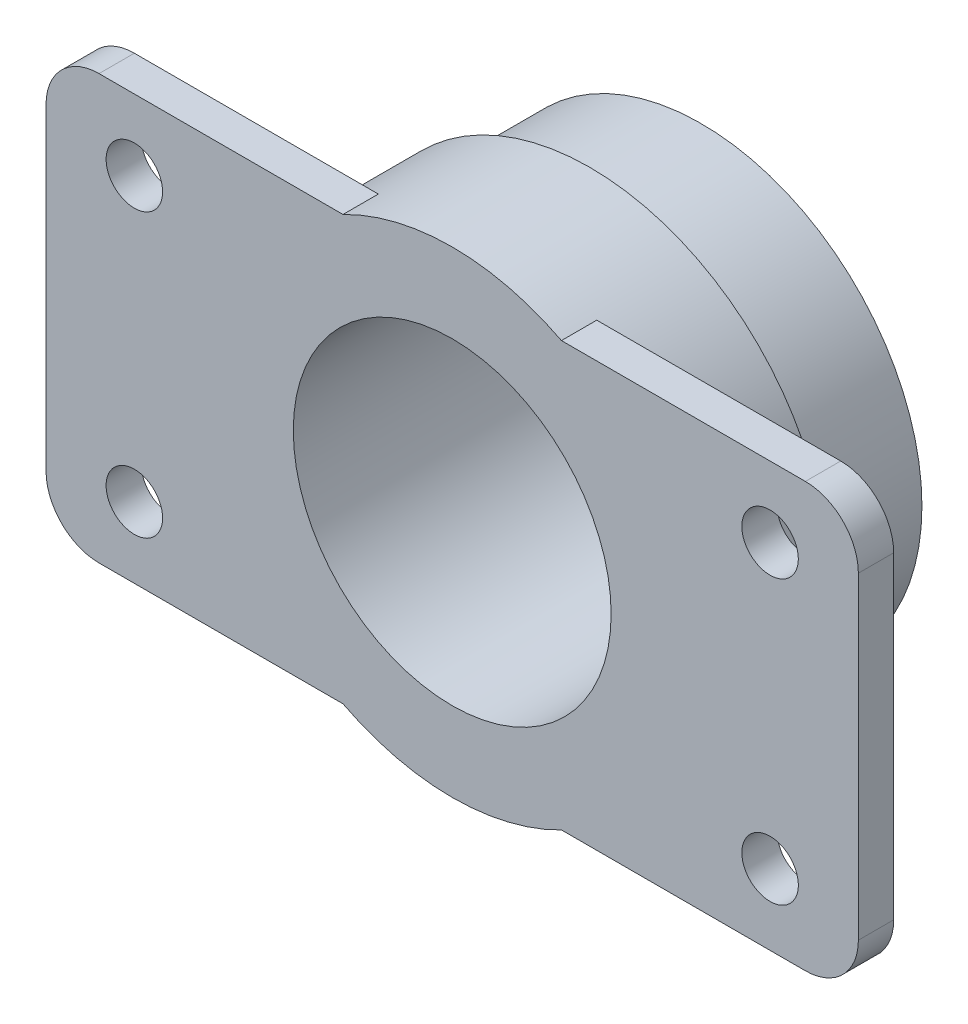
from build123d import *

# Parameters (mm, degrees)
SKETCH_1_R      = 12.5
SKETCH_1_R_2    = 9
EXTRUDE_1_DEPTH = 6.3
SKETCH_2_R      = 13.5
SKETCH_2_R_2    = 9
EXTRUDE_2_DEPTH = 5.8
SKETCH_3_W      = 46
SKETCH_3_H      = 24
SKETCH_3_R      = 9
SKETCH_3_R_2    = 1.6
EXTRUDE_3_DEPTH = 2
FILLET_1_R      = 3
EXTRUDE_4_DEPTH = 2


with BuildPart() as part:
    # 草图1 → 凸台-拉伸1 (new body)
    with BuildSketch(Plane.XY):
        Circle(SKETCH_1_R)
        Circle(SKETCH_1_R_2, mode=Mode.SUBTRACT)
    extrude(amount=EXTRUDE_1_DEPTH)

    # 草图2 → 凸台-拉伸2 (add)
    with BuildSketch(Plane.XY.offset(6.3)):
        Circle(SKETCH_2_R)
        Circle(SKETCH_2_R_2, mode=Mode.SUBTRACT)
    extrude(amount=EXTRUDE_2_DEPTH)

    # 草图3 → 凸台-拉伸3 (add)
    with BuildSketch(Plane.XY.offset(12.1)):
        Rectangle(SKETCH_3_W, SKETCH_3_H)
        Circle(SKETCH_3_R, mode=Mode.SUBTRACT)
        with Locations((18, 8)):
            Circle(SKETCH_3_R_2, mode=Mode.SUBTRACT)
        with Locations(Location((18, -8, 0), (0, 0, 180))):
            Circle(SKETCH_3_R_2, mode=Mode.SUBTRACT)
        with Locations((-18, -8)):
            Circle(SKETCH_3_R_2, mode=Mode.SUBTRACT)
        with Locations(Location((-18, 8, 0), (0, 0, 180))):
            Circle(SKETCH_3_R_2, mode=Mode.SUBTRACT)
    extrude(amount=EXTRUDE_3_DEPTH)

    # 圆角1
    fillet_1_edges = [part.edges().sort_by_distance(p)[0] for p in [
        (23, 12, 13.1),
        (-23, 12, 13.1),
        (-23, -12, 13.1),
        (23, -12, 13.1),
    ]]
    fillet(fillet_1_edges, radius=FILLET_1_R)

    # 草图4 → 凸台-拉伸4 (add)
    with BuildSketch(Plane.XY.offset(12.1)):
        with BuildLine():
            Line((6.184658438, -12), (-6.184658438, -12))
            ThreePointArc((-6.184658438, -12), (0, -13.5), (6.184658438, -12))
        make_face()
        with BuildLine():
            Line((-6.184658438, 12), (6.184658438, 12))
            ThreePointArc((6.184658438, 12), (0, 13.5), (-6.184658438, 12))
        make_face()
    extrude(amount=EXTRUDE_4_DEPTH)


solid = part.part
